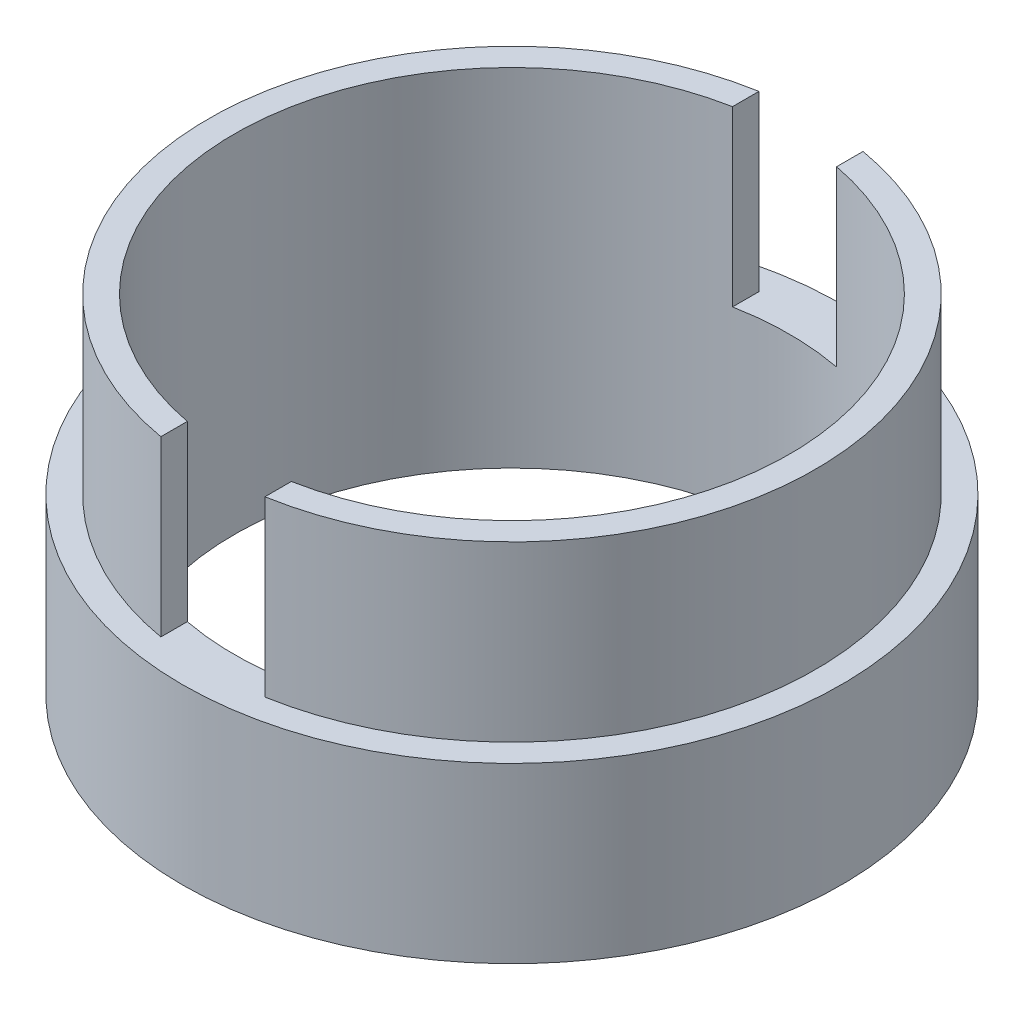
from build123d import *

# Parameters (mm, degrees)
SKETCH1_R               = 95
SKETCH1_R_2             = 80
BOSS_EXTRUDE1_DEPTH     = 50
SKETCH2_R               = 87.5
SKETCH2_R_2             = 80
BOSS_EXTRUDE2_DEPTH     = 50
CUT_EXTRUDE1_DEPTH      = 168.481342244
CUT_EXTRUDE1_DEPTH_BACK = 168.481342244
SCALE1_SCALE            = 0.1


with BuildPart() as part:
    # Sketch1 → Boss-Extrude1 (new body)
    with BuildSketch(Plane(origin=(0, 0, 0), x_dir=(1, 0, 0), z_dir=(0, 1, 0))):
        with Locations(Location((0, 0, 0), (0, 0, 270))):
            Circle(SKETCH1_R)
        with Locations(Location((0, 0, 0), (0, 0, 270))):
            Circle(SKETCH1_R_2, mode=Mode.SUBTRACT)
    extrude(amount=BOSS_EXTRUDE1_DEPTH)

    # Sketch2 → Boss-Extrude2 (add)
    with BuildSketch(Plane(origin=(0, 50, 0), x_dir=(1, 0, 0), z_dir=(0, 1, 0))):
        with Locations(Location((0, 0, 0), (0, 0, 270))):
            Circle(SKETCH2_R)
        with Locations(Location((0, 0, 0), (0, 0, 270))):
            Circle(SKETCH2_R_2, mode=Mode.SUBTRACT)
    extrude(amount=BOSS_EXTRUDE2_DEPTH)

    # Sketch4 → Cut-Extrude1 (cut, two sides: drawn at the far end of the back side and taken through both)
    with BuildSketch(Plane.XY.offset(-CUT_EXTRUDE1_DEPTH_BACK)):
        Polygon((0, 100), (-15, 100), (-15, 50), (15, 50), (15, 100), align=None)
    extrude(amount=CUT_EXTRUDE1_DEPTH + CUT_EXTRUDE1_DEPTH_BACK, mode=Mode.SUBTRACT)


with BuildPart() as part_1:
    # Scale1: scaled about (0, 39.880423453, 0)
    add(part.part.scale(SCALE1_SCALE).moved(Location((0, 35.892381108, 0))))


solid = part_1.part
